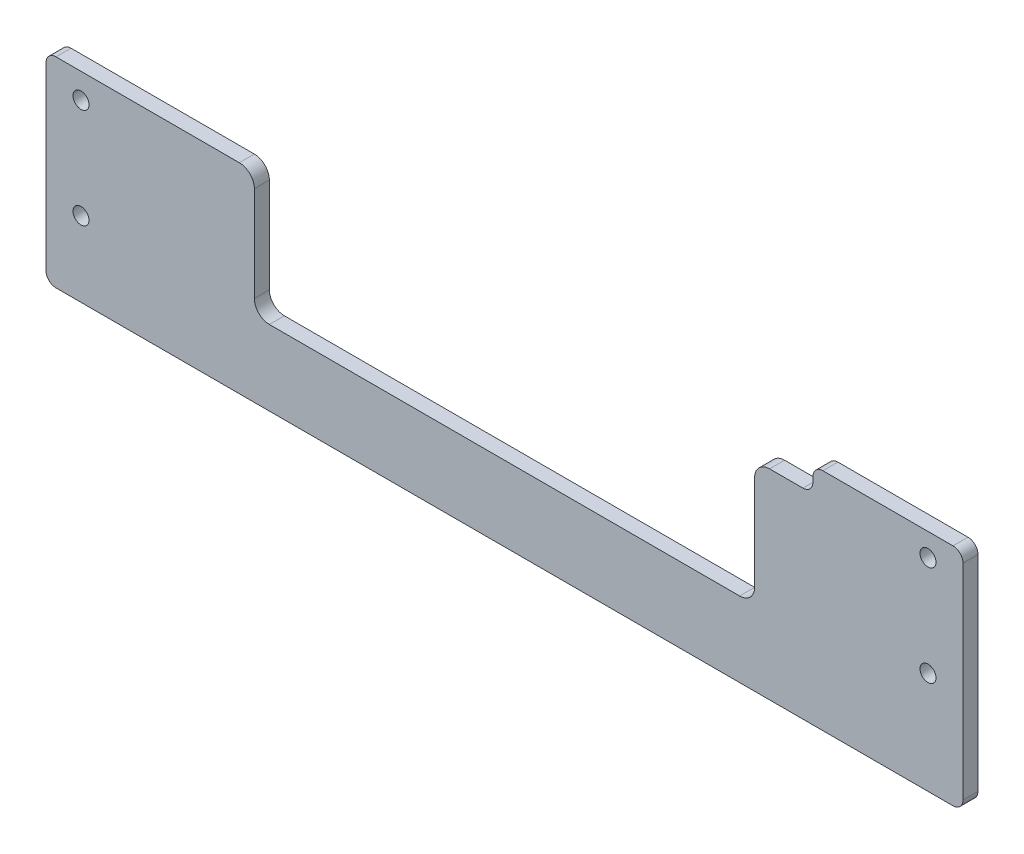
from build123d import *

# Parameters (mm, degrees)
EXTRUDE_1_DEPTH     = 3
FILLET_1_R          = 2
SKETCH_2_R          = 1.6
CUT_EXTRUDE_1_DEPTH = 14
SKETCH_3_W          = 100
SKETCH_3_H          = 25
CUT_EXTRUDE_2_DEPTH = 14
FILLET_2_R          = 3


with BuildPart() as part:
    # 草图1 → 凸台-拉伸1 (new body)
    with BuildSketch(Plane.XY):
        Polygon((0, 0), (183.3, 0), (183.3, 40), (183.3, 45), (153.3, 45), (153.3, 40), (0, 40), align=None)
    extrude(amount=EXTRUDE_1_DEPTH)

    # 圆角1
    fillet_1_edges = [part.edges().sort_by_distance(p)[0] for p in [
        (0, 40, 1.5),
        (153.3, 40, 1.5),
        (153.3, 45, 1.5),
        (183.3, 45, 1.5),
        (183.3, 0, 1.5),
        (0, 0, 1.5),
    ]]
    fillet(fillet_1_edges, radius=FILLET_1_R)

    # 草图2 → 切除-拉伸1 (cut)
    with BuildSketch(Plane(origin=(0, 0, 0), x_dir=(-1, 0, 0), z_dir=(0, 0, -1))):
        with Locations((-176.3, 40.44)):
            Circle(SKETCH_2_R)
        with Locations((-176.3, 20.44)):
            Circle(SKETCH_2_R)
        with Locations((-7, 35)):
            Circle(SKETCH_2_R)
        with Locations((-7, 15)):
            Circle(SKETCH_2_R)
    extrude(amount=-CUT_EXTRUDE_1_DEPTH, mode=Mode.SUBTRACT)

    # 草图3 → 切除-拉伸2 (cut)
    with BuildSketch(Plane(origin=(0, 0, 0), x_dir=(-1, 0, 0), z_dir=(0, 0, -1))):
        with Locations((-91.65, 27.5)):
            Rectangle(SKETCH_3_W, SKETCH_3_H)
    extrude(amount=-CUT_EXTRUDE_2_DEPTH, mode=Mode.SUBTRACT)

    # 圆角2
    fillet_2_edges = [part.edges().sort_by_distance(p)[0] for p in [
        (141.65, 15, 1.5),
        (141.65, 40, 1.5),
        (41.65, 40, 1.5),
        (41.65, 15, 1.5),
    ]]
    fillet(fillet_2_edges, radius=FILLET_2_R)


solid = part.part
